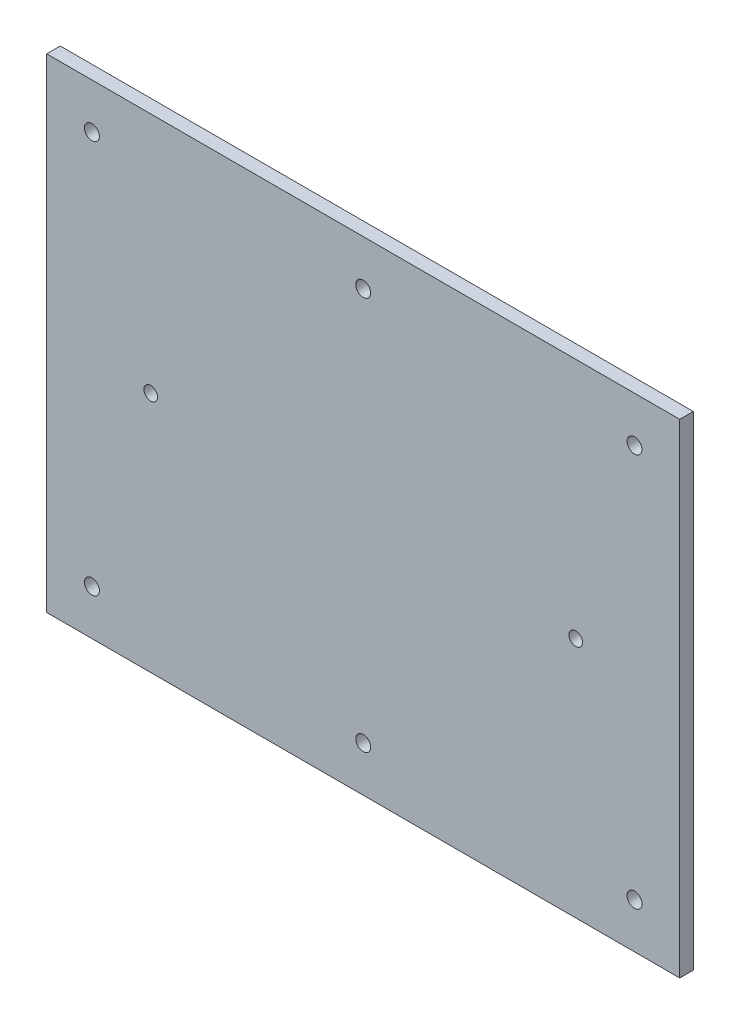
from build123d import *

# Parameters (mm, degrees)
ESQUISSE1_W        = 140
ESQUISSE1_H        = 107
ESQUISSE1_R        = 1.5
ESQUISSE1_R_2      = 1.65
BOSS_EXTRU_1_DEPTH = 3


with BuildPart() as part:
    # Esquisse1 → Boss.-Extru.1 (new body)
    with BuildSketch(Plane.XY):
        with Locations((50, 33.5)):
            Rectangle(ESQUISSE1_W, ESQUISSE1_H)
        with Locations((97, 33.5)):
            Circle(ESQUISSE1_R, mode=Mode.SUBTRACT)
        with Locations((3, 33.5)):
            Circle(ESQUISSE1_R, mode=Mode.SUBTRACT)
        with Locations((110, 77)):
            Circle(ESQUISSE1_R_2, mode=Mode.SUBTRACT)
        with Locations((-10, 77)):
            Circle(ESQUISSE1_R_2, mode=Mode.SUBTRACT)
        with Locations((-10, -10)):
            Circle(ESQUISSE1_R_2, mode=Mode.SUBTRACT)
        with Locations((110, -10)):
            Circle(ESQUISSE1_R_2, mode=Mode.SUBTRACT)
        with Locations((50, 77)):
            Circle(ESQUISSE1_R_2, mode=Mode.SUBTRACT)
        with Locations((50, -10)):
            Circle(ESQUISSE1_R_2, mode=Mode.SUBTRACT)
    extrude(amount=BOSS_EXTRU_1_DEPTH)


solid = part.part
